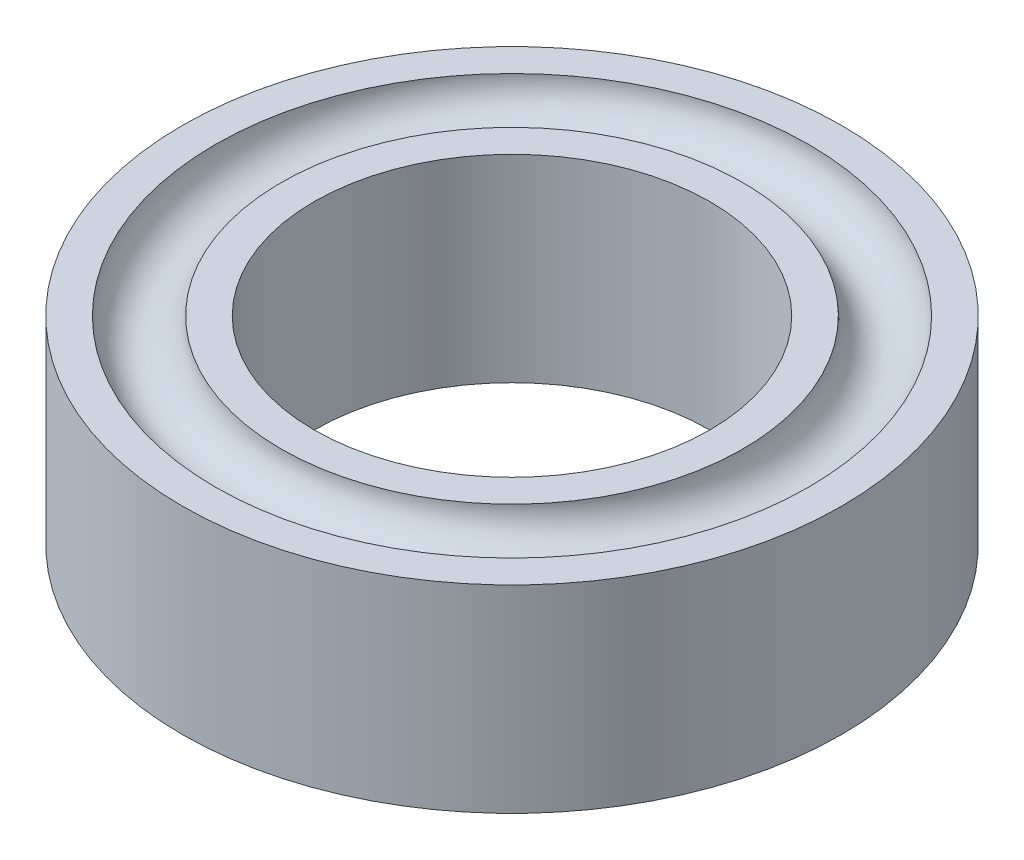
from build123d import *

# Parameters (mm, degrees)
SKETCH2_R          = 3
CUT_EXTRUDE1_DEPTH = 10


with BuildPart() as part:
    # Sketch1 → Revolve1 (revolve)
    with BuildSketch(Plane.XY, mode=Mode.PRIVATE) as revolve1_sk:
        with BuildLine():
            Line((0, 1.5), (3.5, 1.5))
            ThreePointArc((3.5, 1.5), (4, 1), (4.5, 1.5))
            Line((4.5, 1.5), (5, 1.5))
            Line((5, 1.5), (5, -1.5))
            Line((5, -1.5), (4.5, -1.5))
            ThreePointArc((4.5, -1.5), (4, -1), (3.5, -1.5))
            Line((3.5, -1.5), (0, -1.5))
            Line((0, -1.5), (0, 1.5))
        make_face()
    revolve(revolve1_sk.sketch.rotate(Axis((0, 2.010416667, 0), (0, -1, 0)), 90), axis=Axis((0, 2.010416667, 0), (0, -1, 0)))

    # Sketch2 → Cut-Extrude1 (cut)
    with BuildSketch(Plane(origin=(0, 1.5, 0), x_dir=(1, 0, 0), z_dir=(0, 1, 0))):
        with Locations(Location((0, 0, 0), (0, 0, 270))):
            Circle(SKETCH2_R)
    extrude(amount=-CUT_EXTRUDE1_DEPTH, mode=Mode.SUBTRACT)


solid = part.part
